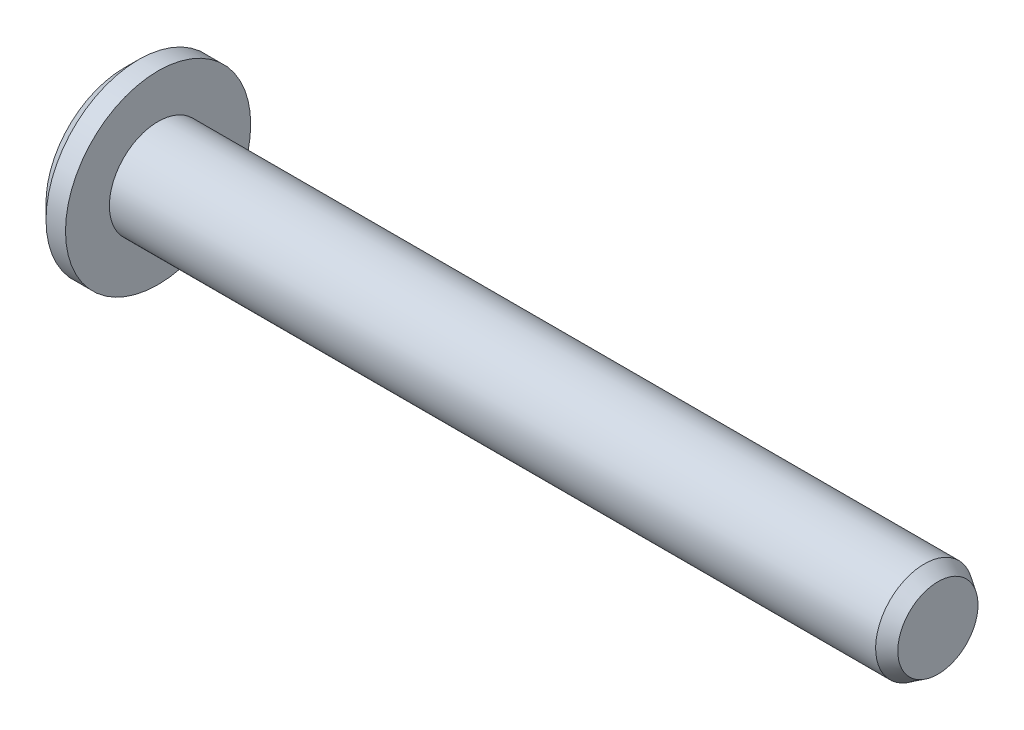
from build123d import *

# Parameters (mm, degrees)
CUT_EXTRUDE1_DEPTH = 1
CHAMFER1_SIZE      = 0.75


with BuildPart() as part:
    # Sketch1 → Revolve1 (revolve)
    with BuildSketch(Plane.XY, mode=Mode.PRIVATE) as revolve1_sk:
        Polygon((41.75, 0), (41.75, 2.057236169), (41.055, 2.5), (1.75, 2.5), (1.75, 4.75), (0, 4.75), (0, 0), align=None)
    revolve(revolve1_sk.sketch.rotate(Axis((0, 0, 0), (1, 0, 0)), 180), axis=Axis((0, 0, 0), (1, 0, 0)))

    # Sketch5 → Cut-Extrude1 (cut)
    with BuildSketch(Plane.ZY):
        Polygon((1.5, -0.866025404), (1.5, 0.866025404), (0, 1.732050808), (-1.5, 0.866025404), (-1.5, -0.866025404), (0, -1.732050808), align=None)
    extrude(amount=-CUT_EXTRUDE1_DEPTH, mode=Mode.SUBTRACT)

    # Chamfer1
    chamfer1_edges = [part.edges().sort_by_distance(p)[0] for p in [
        (0, 4.75, 0),
    ]]
    chamfer(chamfer1_edges, length=CHAMFER1_SIZE)


solid = part.part
